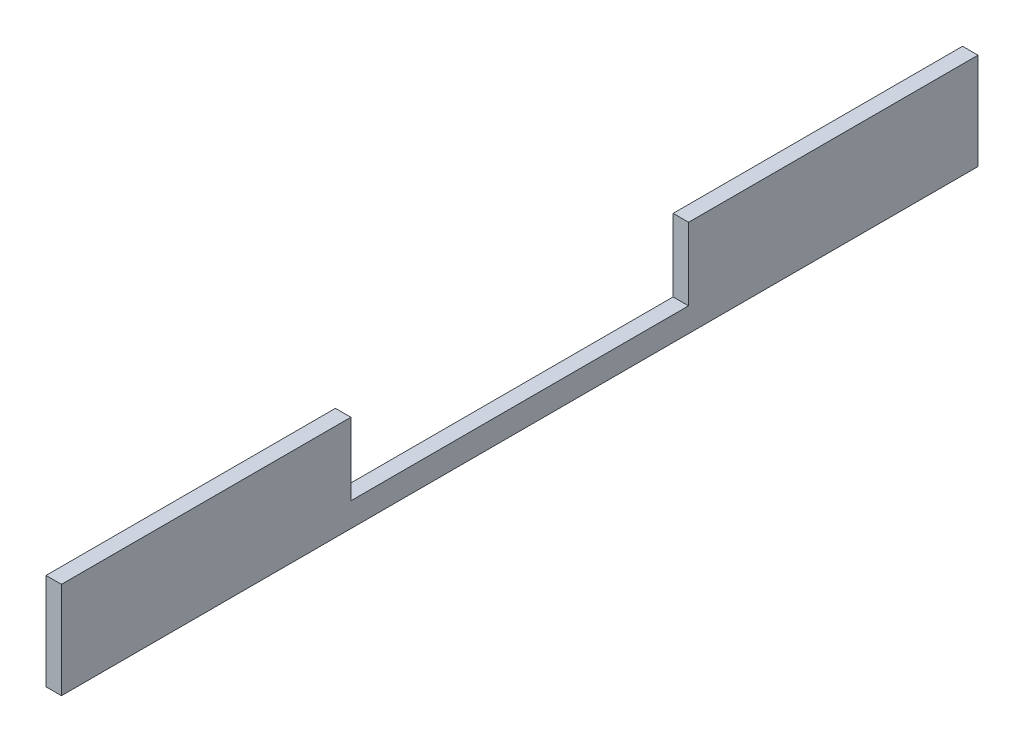
from build123d import *

# Parameters (mm, degrees)
SKETCH1_W           = 190
SKETCH1_H           = 20
BOSS_EXTRUDE1_DEPTH = 3.2
SKETCH2_W           = 35
SKETCH2_H           = 15
CUT_EXTRUDE1_DEPTH  = 10


with BuildPart() as part:
    # Sketch1 → Boss-Extrude1 (new body)
    with BuildSketch(Plane(origin=(0, 0, 0), x_dir=(0, 0, -1), z_dir=(1, 0, 0))):
        with Locations((95, 10)):
            Rectangle(SKETCH1_W, SKETCH1_H)
    extrude(amount=BOSS_EXTRUDE1_DEPTH)

    # Sketch2 → Cut-Extrude1 (cut)
    with BuildSketch(Plane.ZY):
        with Locations((-112.5, 12.5)):
            Rectangle(SKETCH2_W, SKETCH2_H)
        with Locations((-77.5, 12.5)):
            Rectangle(SKETCH2_W, SKETCH2_H)
    extrude(amount=-CUT_EXTRUDE1_DEPTH, mode=Mode.SUBTRACT)


solid = part.part
